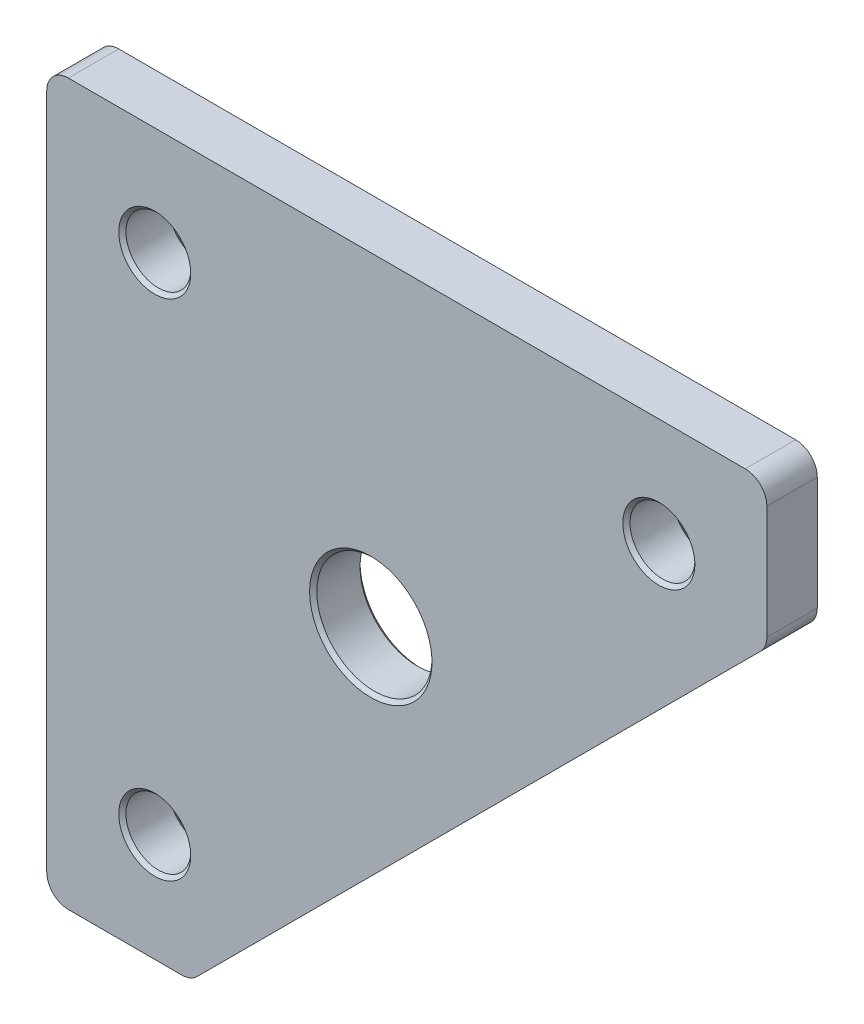
from build123d import *

# Parameters (mm, degrees)
BOSS_EXTRUDE1_DEPTH        = 7
F_9_0_9_DIAMETER_HOLE1_D   = 9
F_16_0_16_DIAMETER_HOLE1_D = 16
F_9_0_9_DIAMETER_HOLE2_D   = 9
CHAMFER1_SIZE              = 0.5
FILLET1_R                  = 3


with BuildPart() as part:
    # Sketch1 → Boss-Extrude1 (new body)
    with BuildSketch(Plane(origin=(0, 0, 0), x_dir=(-1, 0, 0), z_dir=(0, 0, -1))):
        Polygon((0, 0), (-100, 0), (-100, -20), (-20, -100), (0, -100), align=None)
    extrude(amount=-BOSS_EXTRUDE1_DEPTH)

    # Ø9.0 (9) Diameter Hole1 (through all)
    with Locations(Plane.XY.offset(7)):
        with Locations((85, -15), (15, -15)):
            Hole(F_9_0_9_DIAMETER_HOLE1_D / 2)

    # Ø16.0 (16) Diameter Hole1 (through all)
    with Locations(Plane.XY.offset(7)):
        with Locations((45, -45)):
            Hole(F_16_0_16_DIAMETER_HOLE1_D / 2)

    # Ø9.0 (9) Diameter Hole2 (through all)
    with Locations(Plane(origin=(0, 0, 0), x_dir=(-1, 0, 0), z_dir=(0, 0, -1))):
        with Locations((-15, -85)):
            Hole(F_9_0_9_DIAMETER_HOLE2_D / 2)

    # Chamfer1
    chamfer1_edges = [part.edges().sort_by_distance(p)[0] for p in [
        (19.5, -15, 7),
        (19.5, -15, 0),
        (89.5, -15, 7),
        (89.5, -15, 0),
        (53, -45, 7),
        (53, -45, 0),
        (10.5, -85, 0),
        (10.5, -85, 7),
    ]]
    chamfer(chamfer1_edges, length=CHAMFER1_SIZE)

    # Fillet1
    fillet1_edges = [part.edges().sort_by_distance(p)[0] for p in [
        (0, -100, 3.5),
        (20, -100, 3.5),
        (100, -20, 3.5),
        (100, 0, 3.5),
        (0, 0, 3.5),
    ]]
    fillet(fillet1_edges, radius=FILLET1_R)


solid = part.part
